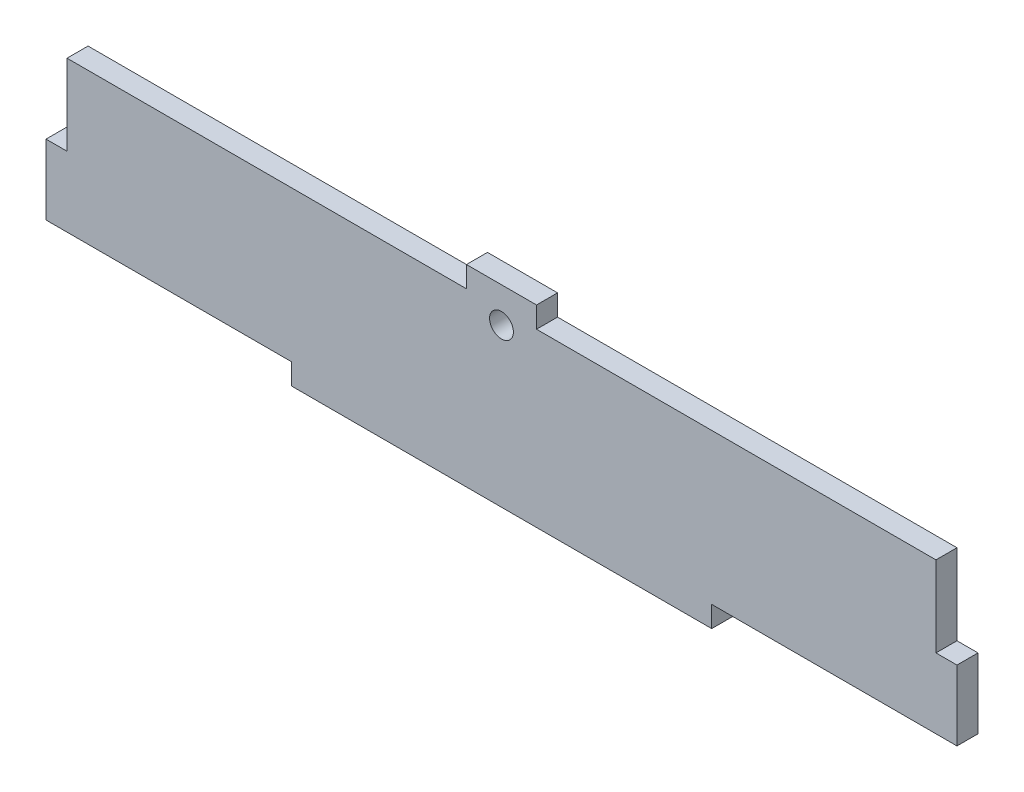
from build123d import *

# Parameters (mm, degrees)
SKETCH1_W              = 260
SKETCH1_H              = 49
BOSS_EXTRUDE1_DEPTH    = 6
SKETCH2_W              = 120
SKETCH2_H              = 6
CUT_EXTRUDE1_DEPTH     = 6
M8X1_25_TAPPED_HOLE1_D = 6.8
CUT_EXTRUDE2_REACH     = 141.058
SKETCH5_W              = 6
SKETCH5_H              = 23
SKETCH6_W              = 120
SKETCH6_H              = 6
BOSS_EXTRUDE2_DEPTH    = 6


with BuildPart() as part:
    # Sketch1 → Boss-Extrude1 (new body)
    with BuildSketch(Plane.XY):
        with Locations((0, 24.5)):
            Rectangle(SKETCH1_W, SKETCH1_H)
    extrude(amount=BOSS_EXTRUDE1_DEPTH)

    # Sketch2 → Cut-Extrude1 (cut)
    with BuildSketch(Plane(origin=(0, 0, 0), x_dir=(-1, 0, 0), z_dir=(0, 0, -1))):
        with Locations((-70, 46)):
            Rectangle(SKETCH2_W, SKETCH2_H)
        with Locations((70, 46)):
            Rectangle(SKETCH2_W, SKETCH2_H)
    extrude(amount=-CUT_EXTRUDE1_DEPTH, mode=Mode.SUBTRACT)

    # M8x1.25 Tapped Hole1 (through all)
    with Locations(Plane(origin=(0, 0, 0), x_dir=(-1, 0, 0), z_dir=(0, 0, -1))):
        with Locations((0, 39)):
            Hole(M8X1_25_TAPPED_HOLE1_D / 2)

    # Sketch5 → Cut-Extrude2 (cut, up to next)
    with BuildSketch(Plane(origin=(0, 0, 0), x_dir=(-1, 0, 0), z_dir=(0, 0, -1)), mode=Mode.PRIVATE) as cut_extrude2_sk1:
        with Locations((-127, 31.5)):
            Rectangle(SKETCH5_W, SKETCH5_H)
    cut_extrude2_tool1 = extrude(cut_extrude2_sk1.sketch, amount=-CUT_EXTRUDE2_REACH, mode=Mode.PRIVATE) & part.part
    # Sketch5 → Cut-Extrude2 (cut, up to next)
    with BuildSketch(Plane(origin=(0, 0, 0), x_dir=(-1, 0, 0), z_dir=(0, 0, -1)), mode=Mode.PRIVATE) as cut_extrude2_sk2:
        with Locations((127, 31.5)):
            Rectangle(SKETCH5_W, SKETCH5_H)
    cut_extrude2_tool2 = extrude(cut_extrude2_sk2.sketch, amount=-CUT_EXTRUDE2_REACH, mode=Mode.PRIVATE) & part.part
    add(cut_extrude2_tool1.solids().sort_by_distance((127, 31.5, 0))[0], mode=Mode.SUBTRACT)
    add(cut_extrude2_tool2.solids().sort_by_distance((-127, 31.5, 0))[0], mode=Mode.SUBTRACT)

    # Sketch6 → Boss-Extrude2 (add)
    with BuildSketch(Plane(origin=(0, 0, 0), x_dir=(-1, 0, 0), z_dir=(0, 0, -1))):
        with Locations((0, -3)):
            Rectangle(SKETCH6_W, SKETCH6_H)
    extrude(amount=-BOSS_EXTRUDE2_DEPTH)


solid = part.part
